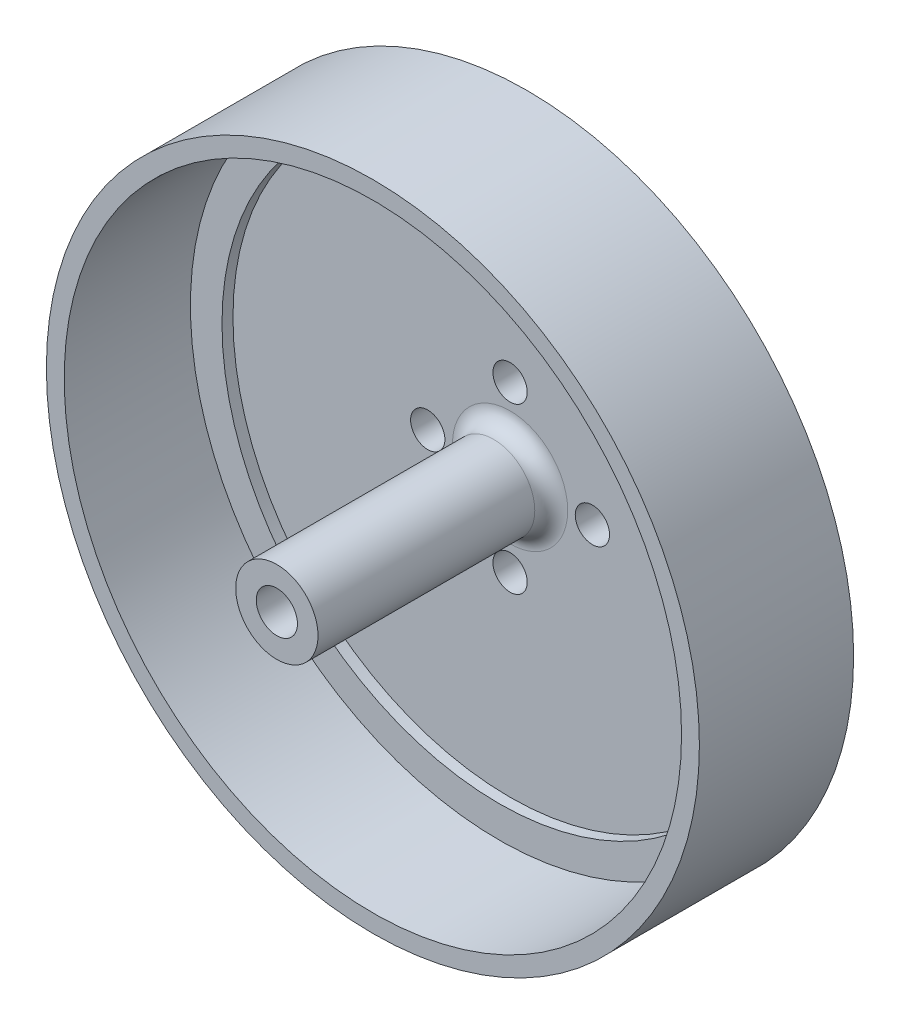
from build123d import *

# Parameters (mm, degrees)
SKETCH1_R               = 23.8
BOSS_EXTRUDE1_DEPTH     = 2.3
SKETCH2_R               = 23.8
SKETCH2_R_2             = 20.2
BOSS_EXTRUDE2_DEPTH     = 10
SKETCH3_R               = 3
BOSS_EXTRUDE3_DEPTH     = 17
CHAMFER1_SIZE           = 6
CHAMFER1_SIZE2          = 1.057961884
SKETCH4_R               = 1.25
CUT_EXTRUDE1_DEPTH      = 15
CUT_EXTRUDE3_START      = -9.2
SKETCH6_R               = 22.5
SKETCH6_R_2             = 20.2
CUT_EXTRUDE3_DEPTH      = 9.2
SKETCH7_R               = 1.5
CUT_EXTRUDE4_DEPTH      = 5
REDONDEO1_R             = 1.2
SALIENTE_EXTRUIR1_START = 1.6
CROQUIS1_R              = 9.339254136
CROQUIS1_R_2            = 1.25
SALIENTE_EXTRUIR1_DEPTH = 1.6
CROQUIS2_R              = 2
SALIENTE_EXTRUIR2_DEPTH = 3
CROQUIS4_R              = 4.654338303
CORTAR_EXTRUIR1_DEPTH   = 2.35


with BuildPart() as part:
    # Sketch1 → Boss-Extrude1 (new body)
    with BuildSketch(Plane.XY):
        Circle(SKETCH1_R)
    extrude(amount=BOSS_EXTRUDE1_DEPTH)

    # Sketch2 → Boss-Extrude2 (add)
    with BuildSketch(Plane.XY.offset(2.3)):
        Circle(SKETCH2_R)
        Circle(SKETCH2_R_2, mode=Mode.SUBTRACT)
    extrude(amount=BOSS_EXTRUDE2_DEPTH)

    # Sketch3 → Boss-Extrude3 (add)
    with BuildSketch(Plane.XY.offset(2.3)):
        Circle(SKETCH3_R)
    extrude(amount=BOSS_EXTRUDE3_DEPTH)

    # Chamfer1
    chamfer1_edges = [part.edges().sort_by_distance(p)[0] for p in [
        (-23.8, 0, 0),
    ]]
    chamfer1_side = [part.faces().sort_by_distance(p)[0] for p in [
        (0, 0, 0),
    ]]
    chamfer(chamfer1_edges, length=CHAMFER1_SIZE, length2=CHAMFER1_SIZE2, reference=chamfer1_side[0])

    # Sketch4 → Cut-Extrude1 (cut)
    with BuildSketch(Plane(origin=(0, 0, 0), x_dir=(-1, 0, 0), z_dir=(0, 0, -1))):
        with Locations((6, 0)):
            Circle(SKETCH4_R)
        with Locations((0, -6)):
            Circle(SKETCH4_R)
        with Locations((-6, 0)):
            Circle(SKETCH4_R)
        with Locations((0, 6)):
            Circle(SKETCH4_R)
    extrude(amount=-CUT_EXTRUDE1_DEPTH, mode=Mode.SUBTRACT)

    # Sketch6 → Cut-Extrude3 (cut)
    with BuildSketch(Plane.XY.offset(12.3).offset(CUT_EXTRUDE3_START)):
        Circle(SKETCH6_R)
        Circle(SKETCH6_R_2, mode=Mode.SUBTRACT)
    extrude(amount=CUT_EXTRUDE3_DEPTH, mode=Mode.SUBTRACT)

    # Sketch7 → Cut-Extrude4 (cut)
    with BuildSketch(Plane.XY.offset(19.3)):
        Circle(SKETCH7_R)
    extrude(amount=-CUT_EXTRUDE4_DEPTH, mode=Mode.SUBTRACT)

    # Redondeo1
    redondeo1_edges = [part.edges().sort_by_distance(p)[0] for p in [
        (-3, 0, 2.3),
    ]]
    fillet(redondeo1_edges, radius=REDONDEO1_R)

    # Croquis1 → Saliente-Extruir1 (add)
    with BuildSketch(Plane(origin=(0, 0, 0), x_dir=(-1, 0, 0), z_dir=(0, 0, -1)).offset(SALIENTE_EXTRUIR1_START)):
        Circle(CROQUIS1_R)
        with Locations((0, 6)):
            Circle(CROQUIS1_R_2, mode=Mode.SUBTRACT)
        with Locations((6, 0)):
            Circle(CROQUIS1_R_2, mode=Mode.SUBTRACT)
        with Locations((0, -6)):
            Circle(CROQUIS1_R_2, mode=Mode.SUBTRACT)
        with Locations((-6, 0)):
            Circle(CROQUIS1_R_2, mode=Mode.SUBTRACT)
    extrude(amount=-SALIENTE_EXTRUIR1_DEPTH)

    # Croquis2 → Saliente-Extruir2 (add)
    with BuildSketch(Plane(origin=(0, 0, -1.6), x_dir=(-1, 0, 0), z_dir=(0, 0, -1))):
        Circle(CROQUIS2_R)
    extrude(amount=SALIENTE_EXTRUIR2_DEPTH)

    # Croquis4 → Cortar-Extruir1 (cut)
    with BuildSketch(Plane(origin=(0, 0, -4.6), x_dir=(-1, 0, 0), z_dir=(0, 0, -1))):
        Circle(CROQUIS4_R)
    extrude(amount=-CORTAR_EXTRUIR1_DEPTH, mode=Mode.SUBTRACT)


solid = part.part
